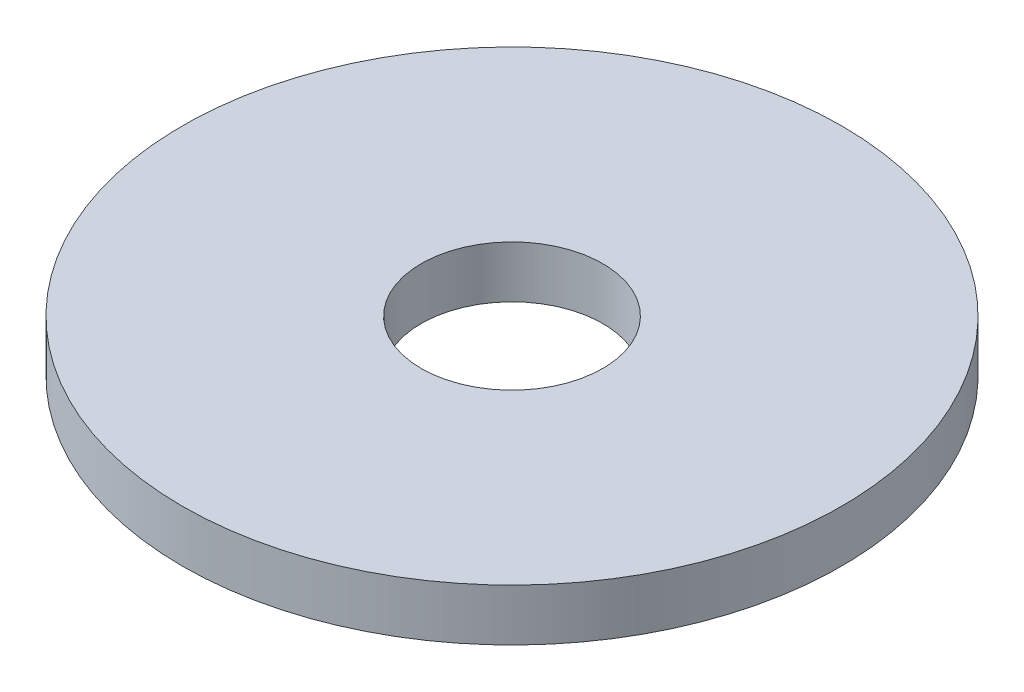
from build123d import *

# Parameters (mm, degrees)
SKETCH1_R           = 12.7
BOSS_EXTRUDE1_DEPTH = 2
SKETCH2_R           = 3.5
CUT_EXTRUDE1_DEPTH  = 2


with BuildPart() as part:
    # Sketch1 → Boss-Extrude1 (new body)
    with BuildSketch(Plane(origin=(0, 0, 0), x_dir=(1, 0, 0), z_dir=(0, 1, 0))):
        with Locations(Location((0, 0, 0), (0, 0, 270))):
            Circle(SKETCH1_R)
    extrude(amount=BOSS_EXTRUDE1_DEPTH)

    # Sketch2 → Cut-Extrude1 (cut)
    with BuildSketch(Plane(origin=(0, 2, 0), x_dir=(1, 0, 0), z_dir=(0, 1, 0))):
        with Locations(Location((0, 0, 0), (0, 0, 270))):
            Circle(SKETCH2_R)
    extrude(amount=-CUT_EXTRUDE1_DEPTH, mode=Mode.SUBTRACT)


solid = part.part
